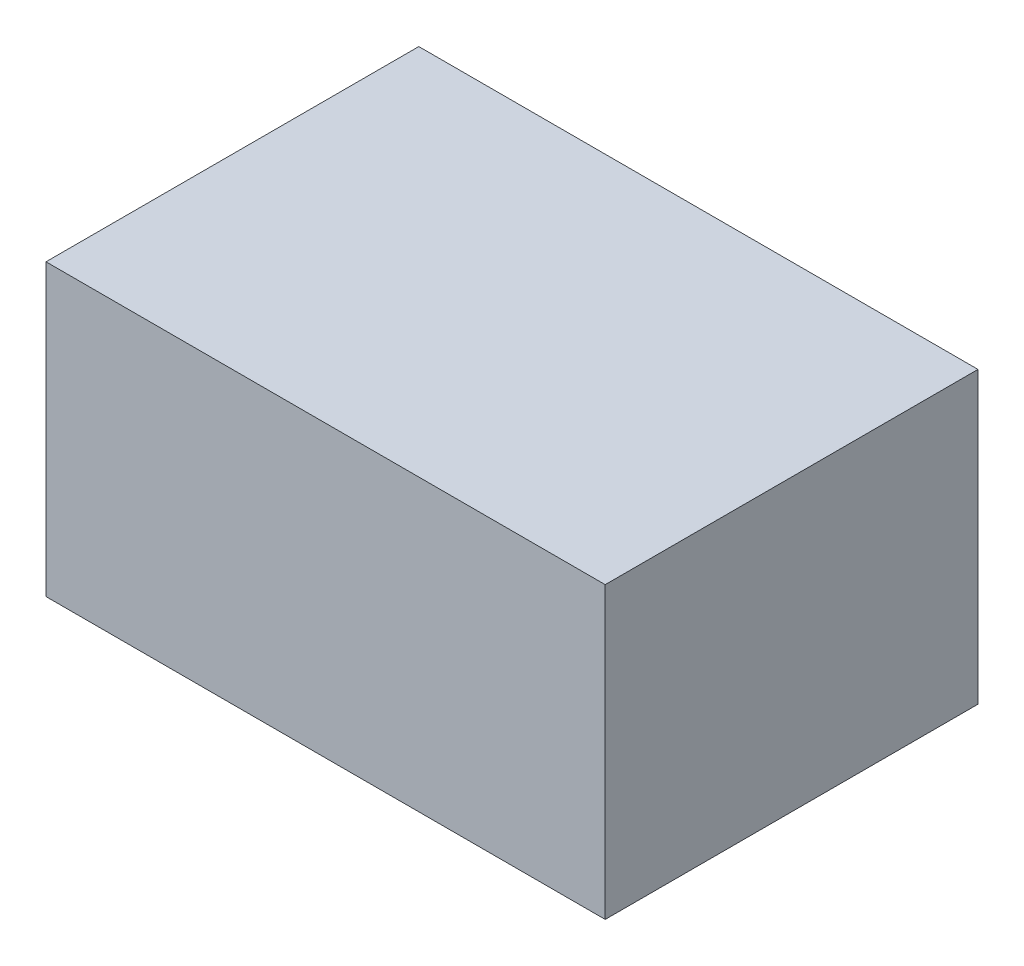
from build123d import *

# Parameters (mm, degrees)
DODANIE_WYCI_GNI_CIE1_DEPTH      = 3
DODANIE_WYCI_GNI_CIE1_DEPTH_BACK = 4
SZKIC2_W                         = 13.5
SZKIC2_H                         = 9


with BuildPart() as part:
    # Szkic2 → Dodanie-wyciągnięcie1 (new, two sides: drawn at the far end of the back side and taken through both)
    with BuildSketch(Plane.XZ.offset(5.349999729).offset(-DODANIE_WYCI_GNI_CIE1_DEPTH_BACK)):
        with Locations((24.836394432, 8.132695234)):
            Rectangle(SZKIC2_W, SZKIC2_H)
    extrude(amount=DODANIE_WYCI_GNI_CIE1_DEPTH + DODANIE_WYCI_GNI_CIE1_DEPTH_BACK)


solid = part.part
